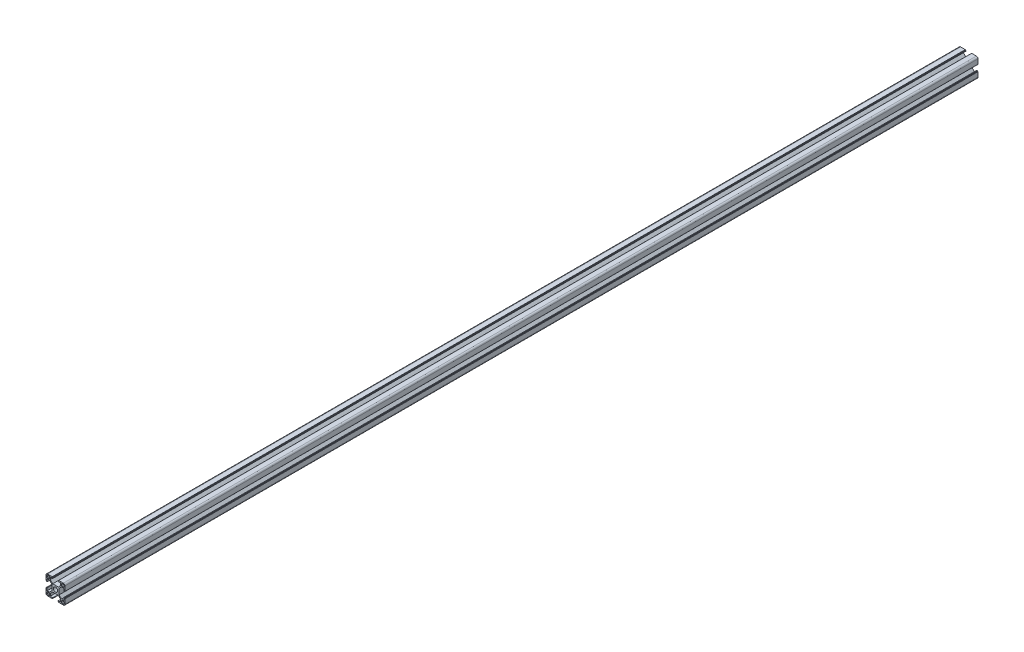
from build123d import *

# Parameters (mm, degrees)
SKETCH1_R      = 3.4
EXTRUDE1_DEPTH = 1441
EXTRUDE2_DEPTH = 1442.15613311


with BuildPart() as part:
    # Sketch1 → Extrude1 (new body)
    with BuildSketch(Plane.XY):
        with BuildLine():
            Line((-5.1, 14.2), (-5.1, 15))
            Line((-5.1, 15), (-12.5, 15))
            ThreePointArc((-12.5, 15), (-14.267766953, 14.267766953), (-15, 12.5))
            Line((-15, 12.5), (-15, 5.1))
            Line((-15, 5.1), (-14.2, 5.1))
            Line((-14.2, 5.1), (-14.2, 4.1))
            Line((-14.2, 4.1), (-13.2, 4.1))
            Line((-13.2, 4.1), (-13.2, 8.25))
            Line((-13.2, 8.25), (-9.522792206, 8.25))
            Line((-9.522792206, 8.25), (-5.7, 4.427207794))
            Line((-5.7, 4.427207794), (-5.7, -4.427207794))
            Line((-5.7, -4.427207794), (-9.522792206, -8.25))
            Line((-9.522792206, -8.25), (-13.2, -8.25))
            Line((-13.2, -8.25), (-13.2, -4.1))
            Line((-13.2, -4.1), (-14.2, -4.1))
            Line((-14.2, -4.1), (-14.2, -5.1))
            Line((-14.2, -5.1), (-15, -5.1))
            Line((-15, -5.1), (-15, -12.5))
            ThreePointArc((-15, -12.5), (-14.267766953, -14.267766953), (-12.5, -15))
            Line((-12.5, -15), (-5.1, -15))
            Line((-5.1, -15), (-5.1, -14.2))
            Line((-5.1, -14.2), (-4.1, -14.2))
            Line((-4.1, -14.2), (-4.1, -13.2))
            Line((-4.1, -13.2), (-8.25, -13.2))
            Line((-8.25, -13.2), (-8.25, -9.522792206))
            Line((-8.25, -9.522792206), (-4.427207794, -5.7))
            Line((-4.427207794, -5.7), (4.427207794, -5.7))
            Line((4.427207794, -5.7), (8.25, -9.522792206))
            Line((8.25, -9.522792206), (8.25, -13.2))
            Line((8.25, -13.2), (4.1, -13.2))
            Line((4.1, -13.2), (4.1, -14.2))
            Line((4.1, -14.2), (5.1, -14.2))
            Line((5.1, -14.2), (5.1, -15))
            Line((5.1, -15), (12.5, -15))
            ThreePointArc((12.5, -15), (14.267766953, -14.267766953), (15, -12.5))
            Line((15, -12.5), (15, -5.1))
            Line((15, -5.1), (14.2, -5.1))
            Line((14.2, -5.1), (14.2, -4.1))
            Line((14.2, -4.1), (13.2, -4.1))
            Line((13.2, -4.1), (13.2, -8.25))
            Line((13.2, -8.25), (9.522792206, -8.25))
            Line((9.522792206, -8.25), (5.7, -4.427207794))
            Line((5.7, -4.427207794), (5.7, 4.427207794))
            Line((5.7, 4.427207794), (9.522792206, 8.25))
            Line((9.522792206, 8.25), (13.2, 8.25))
            Line((13.2, 8.25), (13.2, 4.1))
            Line((13.2, 4.1), (14.2, 4.1))
            Line((14.2, 4.1), (14.2, 5.1))
            Line((14.2, 5.1), (15, 5.1))
            Line((15, 5.1), (15, 12.5))
            ThreePointArc((15, 12.5), (14.267766953, 14.267766953), (12.5, 15))
            Line((12.5, 15), (5.1, 15))
            Line((5.1, 15), (5.1, 14.2))
            Line((5.1, 14.2), (4.1, 14.2))
            Line((4.1, 14.2), (4.1, 13.2))
            Line((4.1, 13.2), (8.25, 13.2))
            Line((8.25, 13.2), (8.25, 9.522792206))
            Line((8.25, 9.522792206), (4.427207794, 5.7))
            Line((4.427207794, 5.7), (-4.427207794, 5.7))
            Line((-4.427207794, 5.7), (-8.25, 9.522792206))
            Line((-8.25, 9.522792206), (-8.25, 13.2))
            Line((-8.25, 13.2), (-4.1, 13.2))
            Line((-4.1, 13.2), (-4.1, 14.2))
            Line((-4.1, 14.2), (-5.1, 14.2))
        make_face()
        with Locations(Location((0, 0, 0), (0, 0, 180))):
            Circle(SKETCH1_R, mode=Mode.SUBTRACT)
    extrude(amount=EXTRUDE1_DEPTH)

    # Sketch2 → Extrude2 (cut, through all)
    with BuildSketch(Plane.XY.offset(1441)):
        with BuildLine():
            Line((13.7, 12.7), (13.7, 10.55))
            ThreePointArc((13.7, 10.55), (13.407106781, 9.842893219), (12.7, 9.55))
            Line((12.7, 9.55), (10.55, 9.55))
            ThreePointArc((10.55, 9.55), (9.842893219, 9.842893219), (9.55, 10.55))
            Line((9.55, 10.55), (9.55, 12.7))
            ThreePointArc((9.55, 12.7), (9.842893219, 13.407106781), (10.55, 13.7))
            Line((10.55, 13.7), (12.7, 13.7))
            ThreePointArc((12.7, 13.7), (13.407106781, 13.407106781), (13.7, 12.7))
        make_face()
        with BuildLine():
            Line((-12.7, 13.7), (-10.55, 13.7))
            ThreePointArc((-10.55, 13.7), (-9.842893219, 13.407106781), (-9.55, 12.7))
            Line((-9.55, 12.7), (-9.55, 10.55))
            ThreePointArc((-9.55, 10.55), (-9.842893219, 9.842893219), (-10.55, 9.55))
            Line((-10.55, 9.55), (-12.7, 9.55))
            ThreePointArc((-12.7, 9.55), (-13.407106781, 9.842893219), (-13.7, 10.55))
            Line((-13.7, 10.55), (-13.7, 12.7))
            ThreePointArc((-13.7, 12.7), (-13.407106781, 13.407106781), (-12.7, 13.7))
        make_face()
        with BuildLine():
            Line((12.7, -13.7), (10.55, -13.7))
            ThreePointArc((10.55, -13.7), (9.842893219, -13.407106781), (9.55, -12.7))
            Line((9.55, -12.7), (9.55, -10.55))
            ThreePointArc((9.55, -10.55), (9.842893219, -9.842893219), (10.55, -9.55))
            Line((10.55, -9.55), (12.7, -9.55))
            ThreePointArc((12.7, -9.55), (13.407106781, -9.842893219), (13.7, -10.55))
            Line((13.7, -10.55), (13.7, -12.7))
            ThreePointArc((13.7, -12.7), (13.407106781, -13.407106781), (12.7, -13.7))
        make_face()
        with BuildLine():
            Line((-13.7, -12.7), (-13.7, -10.55))
            ThreePointArc((-13.7, -10.55), (-13.407106781, -9.842893219), (-12.7, -9.55))
            Line((-12.7, -9.55), (-10.55, -9.55))
            ThreePointArc((-10.55, -9.55), (-9.842893219, -9.842893219), (-9.55, -10.55))
            Line((-9.55, -10.55), (-9.55, -12.7))
            ThreePointArc((-9.55, -12.7), (-9.842893219, -13.407106781), (-10.55, -13.7))
            Line((-10.55, -13.7), (-12.7, -13.7))
            ThreePointArc((-12.7, -13.7), (-13.407106781, -13.407106781), (-13.7, -12.7))
        make_face()
    extrude(amount=-EXTRUDE2_DEPTH, mode=Mode.SUBTRACT)


solid = part.part
